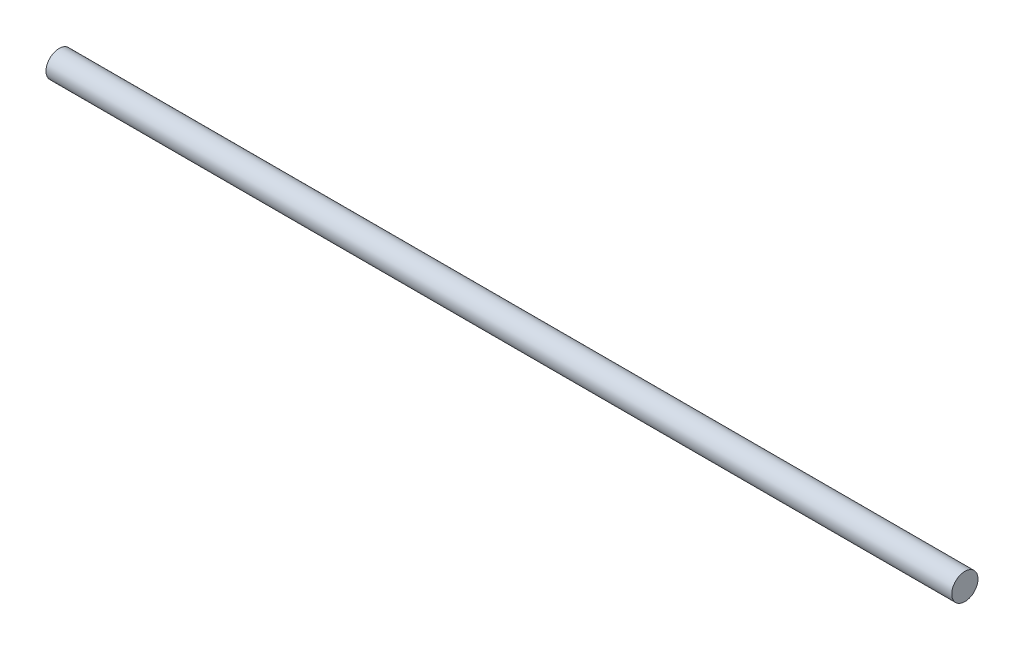
from build123d import *

# Parameters (mm, degrees)
SKETCH_1_R      = 4
EXTRUDE_1_DEPTH = 276


with BuildPart() as part:
    # Эскиз1 → Бобышка-Вытянуть1 (new body)
    with BuildSketch(Plane(origin=(0, 0, 0), x_dir=(0, 0, -1), z_dir=(1, 0, 0))):
        Circle(SKETCH_1_R)
    extrude(amount=EXTRUDE_1_DEPTH)


solid = part.part
